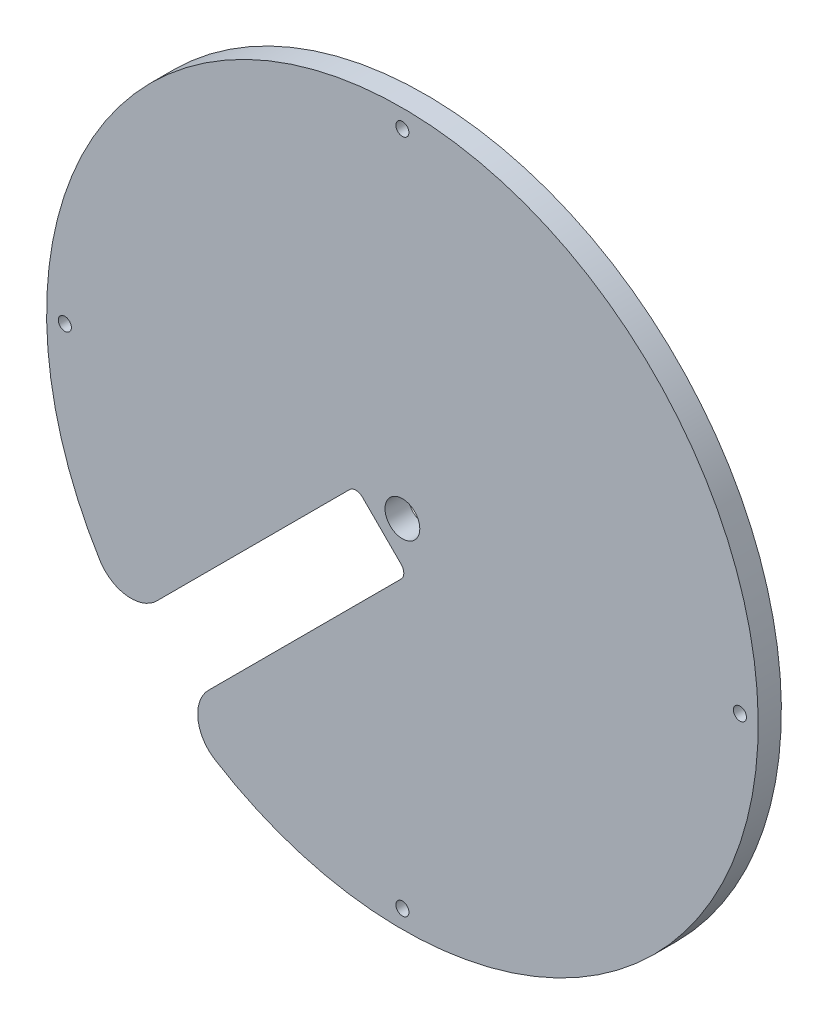
from build123d import *

# Parameters (mm, degrees)
SKETCH1_R           = 97.5
SKETCH1_R_2         = 4.7625
SKETCH1_R_3         = 1.7859375
BOSS_EXTRUDE1_DEPTH = 6.35
CUT_EXTRUDE3_REACH  = 140.032
FILLET2_R           = 10
FILLET3_R           = 2.5


with BuildPart() as part:
    # Sketch1 → Boss-Extrude1 (new body)
    with BuildSketch(Plane.XY):
        Circle(SKETCH1_R)
        Circle(SKETCH1_R_2, mode=Mode.SUBTRACT)
        with Locations((0, 92.5)):
            Circle(SKETCH1_R_3, mode=Mode.SUBTRACT)
        with Locations((92.5, 0)):
            Circle(SKETCH1_R_3, mode=Mode.SUBTRACT)
        with Locations((0, -92.5)):
            Circle(SKETCH1_R_3, mode=Mode.SUBTRACT)
        with Locations((-92.5, 0)):
            Circle(SKETCH1_R_3, mode=Mode.SUBTRACT)
    extrude(amount=BOSS_EXTRUDE1_DEPTH)

    # Sketch5 → Cut-Extrude3 (cut, up to next)
    with BuildSketch(Plane.XY.offset(6.35), mode=Mode.PRIVATE) as cut_extrude3_sk1:
        with BuildLine():
            Line((1.414213562, -12.727922061), (-5.656854249, -5.656854249))
            Line((-5.656854249, -5.656854249), (-68.942911166, -68.942911166))
            ThreePointArc((-68.942911166, -68.942911166), (-65.311752388, -72.392161178), (-61.50826581, -75.650401434))
            Line((-61.50826581, -75.650401434), (1.414213562, -12.727922061))
        make_face()
    cut_extrude3_tool1 = extrude(cut_extrude3_sk1.sketch, amount=-CUT_EXTRUDE3_REACH, mode=Mode.PRIVATE) & part.part
    # Sketch5 → Cut-Extrude3 (cut, up to next)
    with BuildSketch(Plane.XY.offset(6.35), mode=Mode.PRIVATE) as cut_extrude3_sk2:
        with BuildLine():
            Line((-68.942911166, -68.942911166), (-5.656854249, -5.656854249))
            Line((-5.656854249, -5.656854249), (-12.727922061, 1.414213562))
            Line((-12.727922061, 1.414213562), (-75.650401434, -61.50826581))
            ThreePointArc((-75.650401434, -61.50826581), (-72.392161178, -65.311752388), (-68.942911166, -68.942911166))
        make_face()
    cut_extrude3_tool2 = extrude(cut_extrude3_sk2.sketch, amount=-CUT_EXTRUDE3_REACH, mode=Mode.PRIVATE) & part.part
    add(cut_extrude3_tool1.solids().sort_by_distance((-33.7073, -40.771587, 6.35))[0], mode=Mode.SUBTRACT)
    add(cut_extrude3_tool2.solids().sort_by_distance((-40.771587, -33.7073, 6.35))[0], mode=Mode.SUBTRACT)

    # Fillet2
    fillet2_edges = [part.edges().sort_by_distance(p)[0] for p in [
        (-61.50826581, -75.650401434, 3.175),
        (-75.650401434, -61.50826581, 3.175),
    ]]
    fillet(fillet2_edges, radius=FILLET2_R)

    # Fillet3
    fillet3_edges = [part.edges().sort_by_distance(p)[0] for p in [
        (-12.727922061, 1.414213562, 3.175),
        (1.414213562, -12.727922061, 3.175),
    ]]
    fillet(fillet3_edges, radius=FILLET3_R)


solid = part.part
